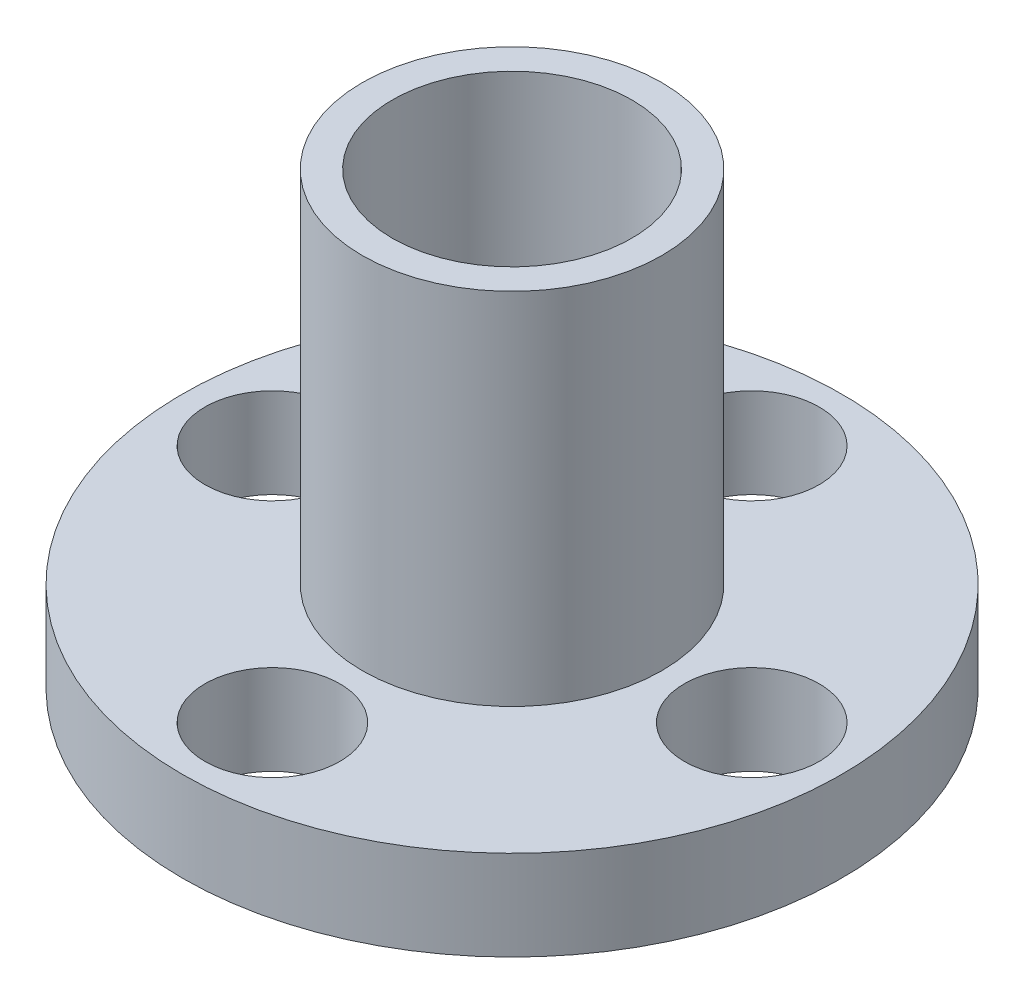
from build123d import *

# Parameters (mm, degrees)
SKETCH1_R           = 11
BOSS_EXTRUDE1_DEPTH = 3
SKETCH2_R           = 5
BOSS_EXTRUDE2_DEPTH = 12
SKETCH3_R           = 4
CUT_EXTRUDE1_DEPTH  = 22.610182785
SKETCH4_R           = 2.25
CUT_EXTRUDE2_DEPTH  = 20.646882704


with BuildPart() as part:
    # Sketch1 → Boss-Extrude1 (new body)
    with BuildSketch(Plane(origin=(0, 0, 0), x_dir=(1, 0, 0), z_dir=(0, 1, 0))):
        with Locations(Location((0, 0, 0), (0, 0, 270))):
            Circle(SKETCH1_R)
    extrude(amount=BOSS_EXTRUDE1_DEPTH)

    # Sketch2 → Boss-Extrude2 (add)
    with BuildSketch(Plane(origin=(0, 3, 0), x_dir=(1, 0, 0), z_dir=(0, 1, 0))):
        with Locations(Location((0, 0, 0), (0, 0, 270))):
            Circle(SKETCH2_R)
    extrude(amount=BOSS_EXTRUDE2_DEPTH)

    # Sketch3 → Cut-Extrude1 (cut, through all)
    with BuildSketch(Plane(origin=(0, 15, 0), x_dir=(1, 0, 0), z_dir=(0, 1, 0))):
        with Locations(Location((0, 0, 0), (0, 0, 270))):
            Circle(SKETCH3_R)
    extrude(amount=-CUT_EXTRUDE1_DEPTH, mode=Mode.SUBTRACT)

    # Sketch4 → Cut-Extrude2 (cut, through all)
    with BuildSketch(Plane(origin=(0, 3, 0), x_dir=(1, 0, 0), z_dir=(0, 1, 0))):
        with Locations(Location((8, 0, 0), (0, 0, 270))):
            Circle(SKETCH4_R)
        with Locations(Location((0, 8, 0), (0, 0, 270))):
            Circle(SKETCH4_R)
        with Locations(Location((-8, 0, 0), (0, 0, 270))):
            Circle(SKETCH4_R)
        with Locations(Location((0, -8, 0), (0, 0, 270))):
            Circle(SKETCH4_R)
    extrude(amount=-CUT_EXTRUDE2_DEPTH, mode=Mode.SUBTRACT)


solid = part.part
